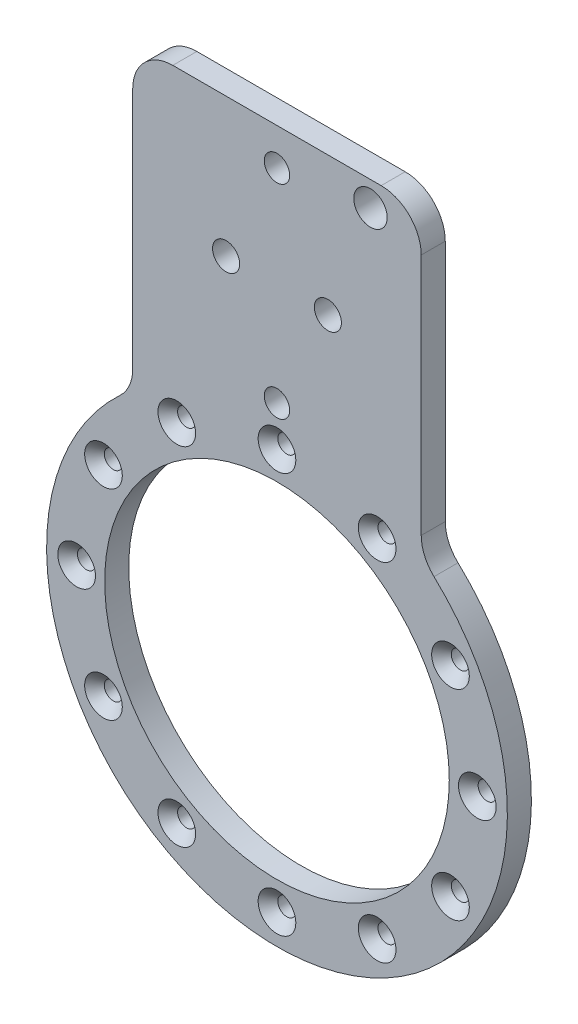
from build123d import *

# Parameters (mm, degrees)
SKETCH1_R                                       = 43
BASE_DEPTH                                      = 3
M4_CLEARANCE_HOLE1_D                            = 4.5
M4_CLEARANCE_HOLE2_D                            = 6.35
F_1_4_CLEARANCE_HOLE1_D                         = 6.7564
FILLET1_R                                       = 10
CSK_FOR_M4_FLAT_HEAD_MACHINE_SCREW1_D           = 4.5
CSK_FOR_M4_FLAT_HEAD_MACHINE_SCREW1_CSINK_D     = 9.4
CSK_FOR_M4_FLAT_HEAD_MACHINE_SCREW1_CSINK_ANGLE = 90
SKETCH15_R                                      = 4.165
CUT_EXTRUDE1_DEPTH                              = 134.200037538


with BuildPart() as part:
    # Sketch1 → base (new, symmetric)
    with BuildSketch(Plane.XY):
        with BuildLine():
            Line((-36, 44.83581158), (-36, 120))
            Line((-36, 120), (36, 120))
            Line((36, 120), (36, 44.83581158))
            ThreePointArc((36, 44.83581158), (0, -57.5), (-36, 44.83581158))
        make_face()
        Circle(SKETCH1_R, mode=Mode.SUBTRACT)
    extrude(amount=BASE_DEPTH, both=True)

    # M4 Clearance Hole1 (through all)
    with Locations(Plane.XY.offset(3)):
        with Locations((0, 50), (25, 43.301270189), (43.301270189, 25), (50, 0), (43.301270189, -25), (25, -43.301270189), (0, -50), (-25, -43.301270189), (-43.301270189, -25), (-50, 0), (-43.301270189, 25), (-25, 43.301270189)):
            Hole(M4_CLEARANCE_HOLE1_D / 2)

    # M4 Clearance Hole2 (through all)
    with Locations(Plane.XY.offset(3)):
        with Locations((0, 60), (0, 110.8)):
            Hole(M4_CLEARANCE_HOLE2_D / 2)

    # 1/4 Clearance Hole1 (through all)
    with Locations(Plane.XY.offset(3)):
        with Locations((-12.7, 85.4), (12.7, 85.4)):
            Hole(F_1_4_CLEARANCE_HOLE1_D / 2)

    # Fillet1
    fillet1_edges = [part.edges().sort_by_distance(p)[0] for p in [
        (36, 120, 0),
        (-36, 120, 0),
        (-36, 44.83581158, 0),
        (36, 44.83581158, 0),
    ]]
    fillet(fillet1_edges, radius=FILLET1_R)

    # CSK for M4 Flat Head Machine Screw1 (through all)
    with Locations(Plane.XY.offset(3)):
        with Locations((0, 50), (25, 43.301270189), (43.301270189, 25), (50, 0), (43.301270189, -25), (25, -43.301270189), (0, -50), (-25, -43.301270189), (-43.301270189, -25), (-50, 0), (-43.301270189, 25), (-25, 43.301270189)):
            CounterSinkHole(CSK_FOR_M4_FLAT_HEAD_MACHINE_SCREW1_D / 2, CSK_FOR_M4_FLAT_HEAD_MACHINE_SCREW1_CSINK_D / 2, counter_sink_angle=CSK_FOR_M4_FLAT_HEAD_MACHINE_SCREW1_CSINK_ANGLE)

    # Sketch15 → Cut-Extrude1 (cut, through all)
    with BuildSketch(Plane(origin=(0, 0, -3), x_dir=(-1, 0, 0), z_dir=(0, 0, -1))):
        with Locations((-23.335, 113.835)):
            Circle(SKETCH15_R)
    extrude(amount=-CUT_EXTRUDE1_DEPTH, mode=Mode.SUBTRACT)


solid = part.part
